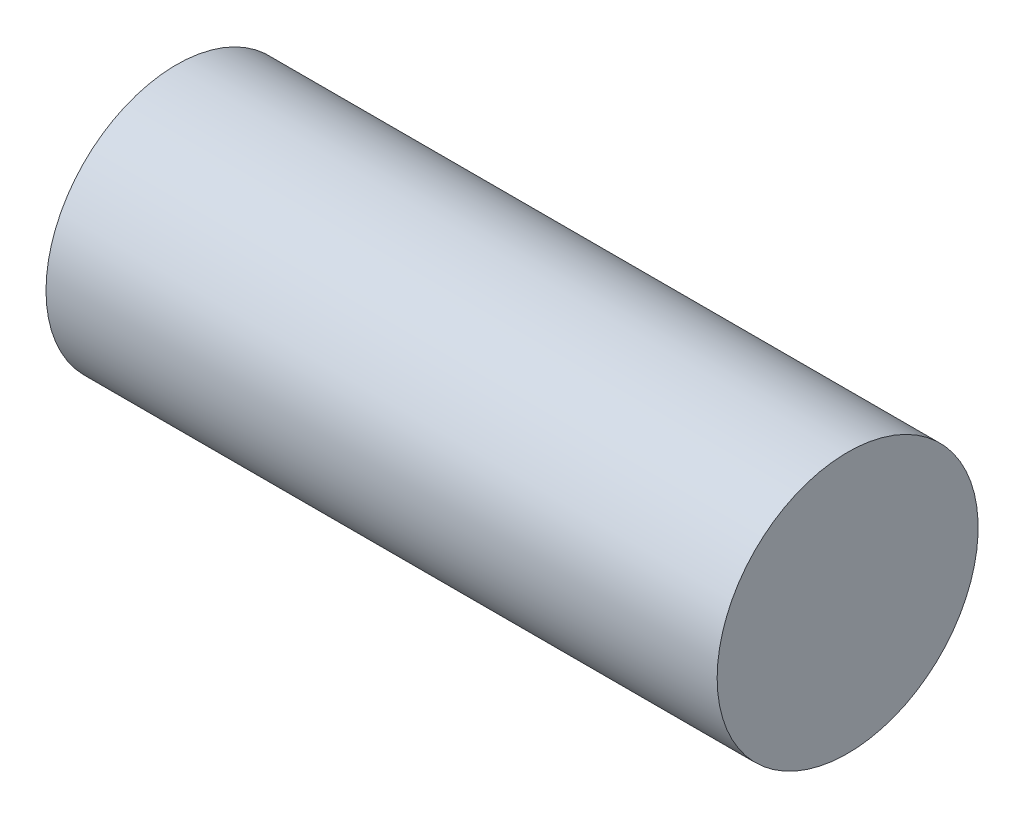
from build123d import *

# Parameters (mm, degrees)
SKETCH1_R           = 35
BOSS_EXTRUDE1_DEPTH = 90


with BuildPart() as part:
    # Sketch1 → Boss-Extrude1 (new, symmetric)
    with BuildSketch(Plane(origin=(0, 0, 0), x_dir=(0, 0, -1), z_dir=(1, 0, 0))):
        with Locations(Location((0, 0, 0), (0, 0, 180))):
            Circle(SKETCH1_R)
    extrude(amount=BOSS_EXTRUDE1_DEPTH, both=True)


solid = part.part
